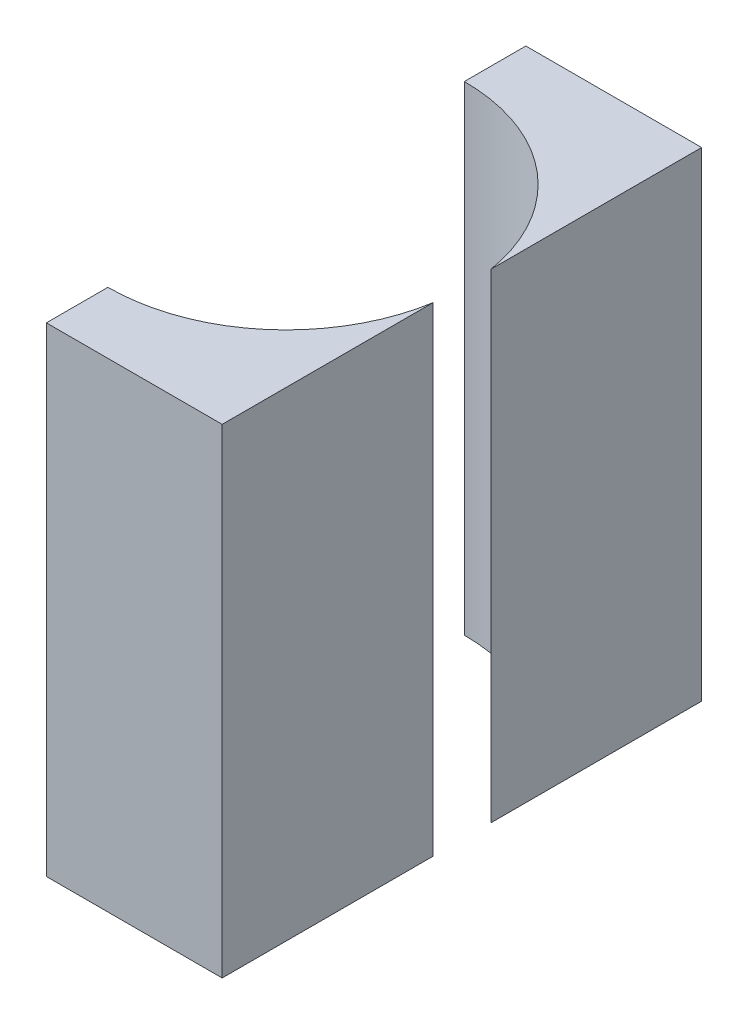
from build123d import *

# Parameters (mm, degrees)
BOSS_EXTRUDE1_DEPTH   = 30
BOSS_EXTRUDE1_2_DEPTH = 30


with BuildPart() as part:
    # Sketch1 → Boss-Extrude1 (new body)
    with BuildSketch(Plane(origin=(0, 86.669072122, 0), x_dir=(1, 0, 0), z_dir=(0, 1, 0))):
        with BuildLine():
            Line((234.787548473, 7.246684875), (245.787548473, 7.246684875))
            Line((245.787548473, 7.246684875), (245.787548473, 11.246684875))
            Line((245.787548473, 11.246684875), (245.787548473, 20.423912262))
            ThreePointArc((245.787548473, 20.423912262), (241.99860198, 13.742379652), (234.787548473, 11.096684875))
            Line((234.787548473, 11.096684875), (234.787548473, 7.246684875))
        make_face()
    extrude(amount=-BOSS_EXTRUDE1_DEPTH)


with BuildPart() as body_2:
    # Sketch1 → Boss-Extrude1 2 (new body)
    with BuildSketch(Plane(origin=(0, 86.669072122, 0), x_dir=(1, 0, 0), z_dir=(0, 1, 0))):
        with BuildLine():
            Line((234.787548473, 37.246684875), (234.787548473, 33.396684875))
            ThreePointArc((234.787548473, 33.396684875), (241.99860198, 30.750990098), (245.787548473, 24.069457488))
            Line((245.787548473, 24.069457488), (245.787548473, 33.246684875))
            Line((245.787548473, 33.246684875), (245.787548473, 37.246684875))
            Line((245.787548473, 37.246684875), (234.787548473, 37.246684875))
        make_face()
    extrude(amount=-BOSS_EXTRUDE1_2_DEPTH)


solid = Compound([part.part, body_2.part])
